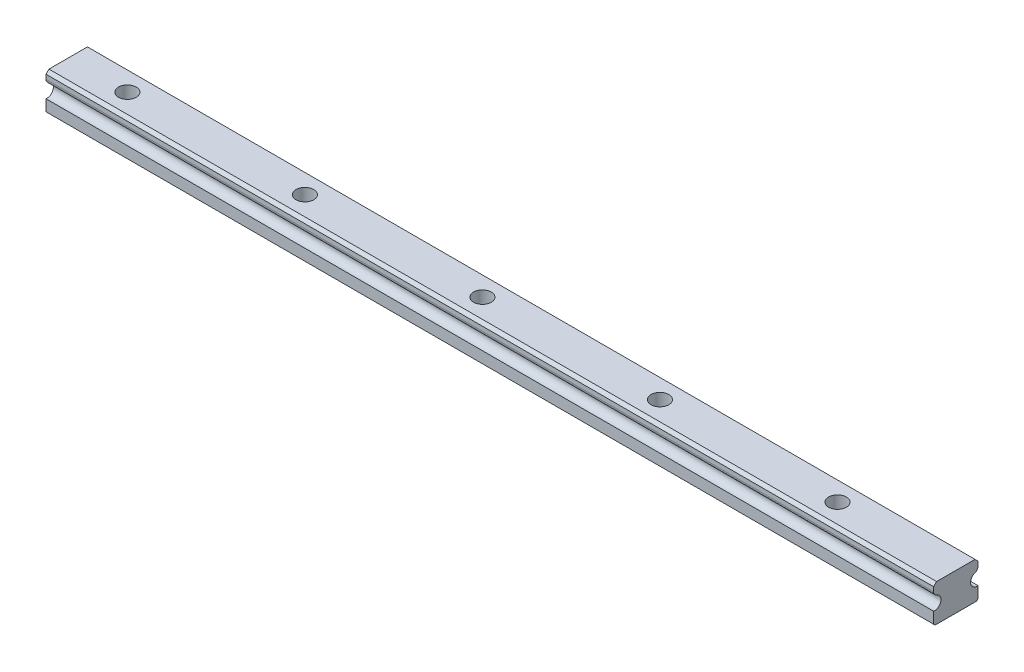
from build123d import *

# Parameters (mm, degrees)
BOSS_EXTRUDE1_DEPTH    = 300
CAP_SCREW1_D           = 3.5
CAP_SCREW1_CBORE_D     = 6
CAP_SCREW1_CBORE_DEPTH = 4.5
SCALE_2_SCALE          = 1.7


with BuildPart() as part:
    # Sketch1 → Boss-Extrude1 (new body)
    with BuildSketch(Plane(origin=(-20, 0, 0), x_dir=(0, 0, -1), z_dir=(1, 0, 0))):
        with BuildLine():
            Line((6.5, 12.5), (7.5, 11.5))
            Line((7.5, 11.5), (7.5, 10))
            ThreePointArc((7.5, 10), (7.220600207, 9.128142709), (6.486486486, 8.581081081))
            ThreePointArc((6.486486486, 8.581081081), (5.059724666, 5.990862007), (7.5, 4.320550528))
            Line((7.5, 4.320550528), (7.5, 0.5))
            Line((7.5, 0.5), (7, 0))
            Line((7, 0), (-7, 0))
            Line((-7, 0), (-7.5, 0.5))
            Line((-7.5, 0.5), (-7.5, 4.320550528))
            ThreePointArc((-7.5, 4.320550528), (-5.059724666, 5.990862007), (-6.486486486, 8.581081081))
            ThreePointArc((-6.486486486, 8.581081081), (-7.220600207, 9.128142709), (-7.5, 10))
            Line((-7.5, 10), (-7.5, 11.5))
            Line((-7.5, 11.5), (-6.5, 12.5))
            Line((-6.5, 12.5), (6.5, 12.5))
        make_face()
    extrude(amount=BOSS_EXTRUDE1_DEPTH)

    # Cap Screw1 (through all)
    with Locations(Plane(origin=(0, 12.5, 0), x_dir=(1, 0, 0), z_dir=(0, 1, 0))):
        with Locations((0, 0), (60, 0), (120, 0), (180, 0), (240, 0), (300, 0), (360, 0), (420, 0)):
            CounterBoreHole(CAP_SCREW1_D / 2, CAP_SCREW1_CBORE_D / 2, CAP_SCREW1_CBORE_DEPTH)


with BuildPart() as part_1:
    # 缩放比例2: scaled about (0, 0, 0)
    add(part.part.scale(SCALE_2_SCALE))


solid = part_1.part
